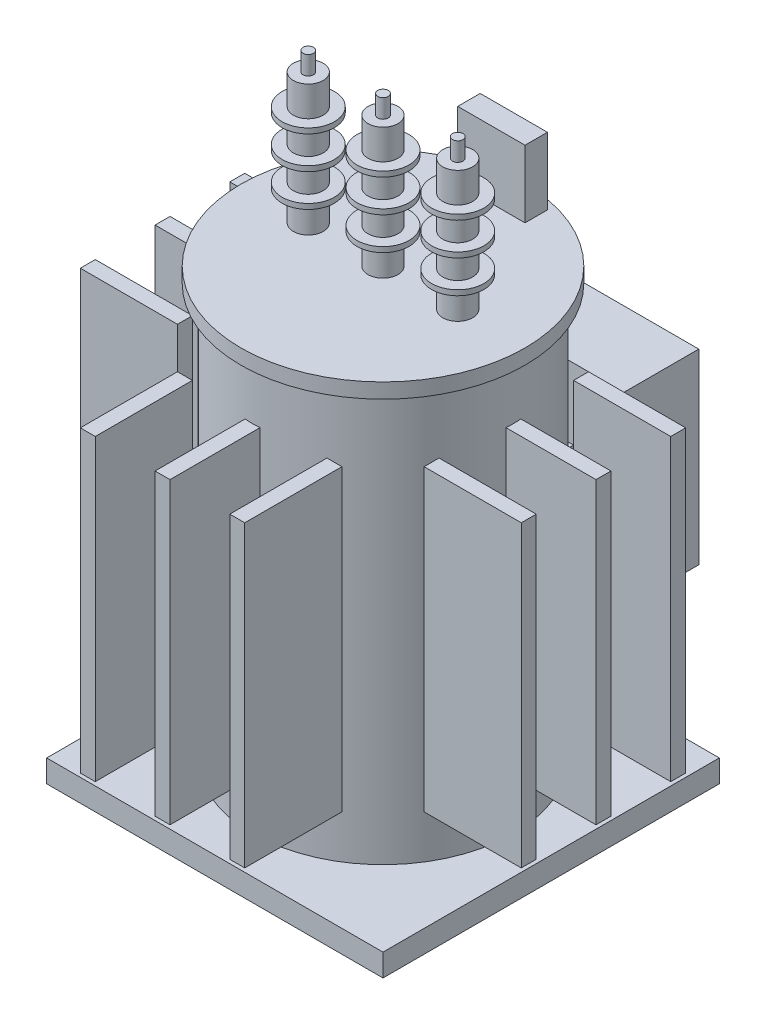
from build123d import *

# Parameters (mm, degrees)
SKETCH1_W                = 900
SKETCH1_H                = 900
BASE_DEPTH               = 60
TANK_START               = 60
SKETCH2_R                = 350
TANK_DEPTH               = 1100
LID_START                = 1160
SKETCH3_R                = 380
LID_DEPTH                = 40
FIN_START                = 210
SKETCH4_W                = 260
SKETCH4_H                = 40
FIN_X_1_DEPTH            = 800
SKETCH5_W                = 260
SKETCH5_H                = 40
FIN_X_1_2_DEPTH          = 800
SKETCH6_W                = 40
SKETCH6_H                = 260
FIN_Z_1_DEPTH            = 800
SKETCH7_W                = 260
SKETCH7_H                = 40
FIN_X_2_DEPTH            = 800
SKETCH8_W                = 260
SKETCH8_H                = 40
FIN_X_2_2_DEPTH          = 800
SKETCH9_W                = 40
SKETCH9_H                = 260
FIN_Z_2_DEPTH            = 800
SKETCH10_W               = 260
SKETCH10_H               = 40
FIN_X_3_DEPTH            = 800
SKETCH11_W               = 260
SKETCH11_H               = 40
FIN_X_3_2_DEPTH          = 800
SKETCH12_W               = 40
SKETCH12_H               = 260
FIN_Z_3_DEPTH            = 800
BUSHING_START            = 1200
SKETCH13_R               = 40
BUSHING_S_DEPTH          = 350
SHED_START               = 1280.5
SKETCH14_R               = 70
SHED_S_1_DEPTH           = 14
SHED_START_2             = 1368
SKETCH15_R               = 70
SHED_S_2_DEPTH           = 14
SHED_START_3             = 1455.5
SKETCH16_R               = 70
SHED_S_3_DEPTH           = 14
TERMINAL_START           = 1550
SKETCH17_R               = 14
TERMINAL_S_DEPTH         = 50
SKETCH18_R               = 40
BUSHING_L_DEPTH          = 350
SKETCH19_R               = 70
SHED_L_1_DEPTH           = 14
SKETCH20_R               = 70
SHED_L_2_DEPTH           = 14
SKETCH21_R               = 70
SHED_L_3_DEPTH           = 14
SKETCH22_R               = 14
TERMINAL_L_DEPTH         = 50
SKETCH23_R               = 40
BUSHING_SL_DEPTH         = 350
SKETCH24_R               = 70
SHED_SL_1_DEPTH          = 14
SKETCH25_R               = 70
SHED_SL_2_DEPTH          = 14
SKETCH26_R               = 70
SHED_SL_3_DEPTH          = 14
SKETCH27_R               = 14
TERMINAL_SL_DEPTH        = 50
POSITION_START           = 1200
SKETCH28_W               = 180
SKETCH28_H               = 60
POSITION_INDICATOR_DEPTH = 180
CONTROL_START            = 260
SKETCH29_W               = 350
SKETCH29_H               = 200
CONTROL_CABINET_DEPTH    = 500
CABINET_START            = 510
SKETCH30_W               = 80
SKETCH30_H               = 140
CABINET_BRACKET_DEPTH    = 60


with BuildPart() as part:
    # Sketch1 → Base (new body)
    with BuildSketch(Plane(origin=(0, 0, 0), x_dir=(1, 0, 0), z_dir=(0, 1, 0))):
        Rectangle(SKETCH1_W, SKETCH1_H)
    extrude(amount=BASE_DEPTH)


with BuildPart() as body_2:
    # Sketch2 → Tank (new body)
    with BuildSketch(Plane(origin=(0, 0, 0), x_dir=(1, 0, 0), z_dir=(0, 1, 0)).offset(TANK_START)):
        with Locations(Location((0, 0, 0), (0, 0, 270))):
            Circle(SKETCH2_R)
    extrude(amount=TANK_DEPTH)


with BuildPart() as body_3:
    # Sketch3 → Lid (new body)
    with BuildSketch(Plane(origin=(0, 0, 0), x_dir=(1, 0, 0), z_dir=(0, 1, 0)).offset(LID_START)):
        with Locations(Location((0, 0, 0), (0, 0, 270))):
            Circle(SKETCH3_R)
    extrude(amount=LID_DEPTH)


with BuildPart() as body_4:
    # Sketch4 → Fin _x 1 (new body)
    with BuildSketch(Plane(origin=(0, 0, 0), x_dir=(1, 0, 0), z_dir=(0, 1, 0)).offset(FIN_START)):
        with Locations((460, 200)):
            Rectangle(SKETCH4_W, SKETCH4_H)
    extrude(amount=FIN_X_1_DEPTH)


with BuildPart() as body_5:
    # Sketch5 → Fin -x 1 2 (new body)
    with BuildSketch(Plane(origin=(0, 0, 0), x_dir=(1, 0, 0), z_dir=(0, 1, 0)).offset(FIN_START)):
        with Locations((-460, 200)):
            Rectangle(SKETCH5_W, SKETCH5_H)
    extrude(amount=FIN_X_1_2_DEPTH)


with BuildPart() as body_6:
    # Sketch6 → Fin +z 1 (new body)
    with BuildSketch(Plane(origin=(0, 0, 0), x_dir=(1, 0, 0), z_dir=(0, 1, 0)).offset(FIN_START)):
        with Locations((-200, -460)):
            Rectangle(SKETCH6_W, SKETCH6_H)
    extrude(amount=FIN_Z_1_DEPTH)


with BuildPart() as body_7:
    # Sketch7 → Fin _x 2 (new body)
    with BuildSketch(Plane(origin=(0, 0, 0), x_dir=(1, 0, 0), z_dir=(0, 1, 0)).offset(FIN_START)):
        with Locations((460, 0)):
            Rectangle(SKETCH7_W, SKETCH7_H)
    extrude(amount=FIN_X_2_DEPTH)


with BuildPart() as body_8:
    # Sketch8 → Fin -x 2 2 (new body)
    with BuildSketch(Plane(origin=(0, 0, 0), x_dir=(1, 0, 0), z_dir=(0, 1, 0)).offset(FIN_START)):
        with Locations((-460, 0)):
            Rectangle(SKETCH8_W, SKETCH8_H)
    extrude(amount=FIN_X_2_2_DEPTH)


with BuildPart() as body_9:
    # Sketch9 → Fin +z 2 (new body)
    with BuildSketch(Plane(origin=(0, 0, 0), x_dir=(1, 0, 0), z_dir=(0, 1, 0)).offset(FIN_START)):
        with Locations((0, -460)):
            Rectangle(SKETCH9_W, SKETCH9_H)
    extrude(amount=FIN_Z_2_DEPTH)


with BuildPart() as body_10:
    # Sketch10 → Fin _x 3 (new body)
    with BuildSketch(Plane(origin=(0, 0, 0), x_dir=(1, 0, 0), z_dir=(0, 1, 0)).offset(FIN_START)):
        with Locations((460, -200)):
            Rectangle(SKETCH10_W, SKETCH10_H)
    extrude(amount=FIN_X_3_DEPTH)


with BuildPart() as body_11:
    # Sketch11 → Fin -x 3 2 (new body)
    with BuildSketch(Plane(origin=(0, 0, 0), x_dir=(1, 0, 0), z_dir=(0, 1, 0)).offset(FIN_START)):
        with Locations((-460, -200)):
            Rectangle(SKETCH11_W, SKETCH11_H)
    extrude(amount=FIN_X_3_2_DEPTH)


with BuildPart() as body_12:
    # Sketch12 → Fin +z 3 (new body)
    with BuildSketch(Plane(origin=(0, 0, 0), x_dir=(1, 0, 0), z_dir=(0, 1, 0)).offset(FIN_START)):
        with Locations((200, -460)):
            Rectangle(SKETCH12_W, SKETCH12_H)
    extrude(amount=FIN_Z_3_DEPTH)


with BuildPart() as body_13:
    # Sketch13 → Bushing S (new body)
    with BuildSketch(Plane(origin=(0, 0, 0), x_dir=(1, 0, 0), z_dir=(0, 1, 0)).offset(BUSHING_START)):
        with Locations(Location((-200, 0, 0), (0, 0, 270))):
            Circle(SKETCH13_R)
    extrude(amount=BUSHING_S_DEPTH)


with BuildPart() as body_14:
    # Sketch14 → Shed S 1 (new body)
    with BuildSketch(Plane(origin=(0, 0, 0), x_dir=(1, 0, 0), z_dir=(0, 1, 0)).offset(SHED_START)):
        with Locations(Location((-200, 0, 0), (0, 0, 270))):
            Circle(SKETCH14_R)
    extrude(amount=SHED_S_1_DEPTH)


with BuildPart() as body_15:
    # Sketch15 → Shed S 2 (new body)
    with BuildSketch(Plane(origin=(0, 0, 0), x_dir=(1, 0, 0), z_dir=(0, 1, 0)).offset(SHED_START_2)):
        with Locations(Location((-200, 0, 0), (0, 0, 270))):
            Circle(SKETCH15_R)
    extrude(amount=SHED_S_2_DEPTH)


with BuildPart() as body_16:
    # Sketch16 → Shed S 3 (new body)
    with BuildSketch(Plane(origin=(0, 0, 0), x_dir=(1, 0, 0), z_dir=(0, 1, 0)).offset(SHED_START_3)):
        with Locations(Location((-200, 0, 0), (0, 0, 270))):
            Circle(SKETCH16_R)
    extrude(amount=SHED_S_3_DEPTH)


with BuildPart() as body_17:
    # Sketch17 → Terminal S (new body)
    with BuildSketch(Plane(origin=(0, 0, 0), x_dir=(1, 0, 0), z_dir=(0, 1, 0)).offset(TERMINAL_START)):
        with Locations(Location((-200, 0, 0), (0, 0, 270))):
            Circle(SKETCH17_R)
    extrude(amount=TERMINAL_S_DEPTH)


with BuildPart() as body_18:
    # Sketch18 → Bushing L (new body)
    with BuildSketch(Plane(origin=(0, 0, 0), x_dir=(1, 0, 0), z_dir=(0, 1, 0)).offset(BUSHING_START)):
        with Locations(Location((0, 0, 0), (0, 0, 270))):
            Circle(SKETCH18_R)
    extrude(amount=BUSHING_L_DEPTH)


with BuildPart() as body_19:
    # Sketch19 → Shed L 1 (new body)
    with BuildSketch(Plane(origin=(0, 0, 0), x_dir=(1, 0, 0), z_dir=(0, 1, 0)).offset(SHED_START)):
        with Locations(Location((0, 0, 0), (0, 0, 270))):
            Circle(SKETCH19_R)
    extrude(amount=SHED_L_1_DEPTH)


with BuildPart() as body_20:
    # Sketch20 → Shed L 2 (new body)
    with BuildSketch(Plane(origin=(0, 0, 0), x_dir=(1, 0, 0), z_dir=(0, 1, 0)).offset(SHED_START_2)):
        with Locations(Location((0, 0, 0), (0, 0, 270))):
            Circle(SKETCH20_R)
    extrude(amount=SHED_L_2_DEPTH)


with BuildPart() as body_21:
    # Sketch21 → Shed L 3 (new body)
    with BuildSketch(Plane(origin=(0, 0, 0), x_dir=(1, 0, 0), z_dir=(0, 1, 0)).offset(SHED_START_3)):
        with Locations(Location((0, 0, 0), (0, 0, 270))):
            Circle(SKETCH21_R)
    extrude(amount=SHED_L_3_DEPTH)


with BuildPart() as body_22:
    # Sketch22 → Terminal L (new body)
    with BuildSketch(Plane(origin=(0, 0, 0), x_dir=(1, 0, 0), z_dir=(0, 1, 0)).offset(TERMINAL_START)):
        with Locations(Location((0, 0, 0), (0, 0, 270))):
            Circle(SKETCH22_R)
    extrude(amount=TERMINAL_L_DEPTH)


with BuildPart() as body_23:
    # Sketch23 → Bushing SL (new body)
    with BuildSketch(Plane(origin=(0, 0, 0), x_dir=(1, 0, 0), z_dir=(0, 1, 0)).offset(BUSHING_START)):
        with Locations(Location((200, 0, 0), (0, 0, 270))):
            Circle(SKETCH23_R)
    extrude(amount=BUSHING_SL_DEPTH)


with BuildPart() as body_24:
    # Sketch24 → Shed SL 1 (new body)
    with BuildSketch(Plane(origin=(0, 0, 0), x_dir=(1, 0, 0), z_dir=(0, 1, 0)).offset(SHED_START)):
        with Locations(Location((200, 0, 0), (0, 0, 270))):
            Circle(SKETCH24_R)
    extrude(amount=SHED_SL_1_DEPTH)


with BuildPart() as body_25:
    # Sketch25 → Shed SL 2 (new body)
    with BuildSketch(Plane(origin=(0, 0, 0), x_dir=(1, 0, 0), z_dir=(0, 1, 0)).offset(SHED_START_2)):
        with Locations(Location((200, 0, 0), (0, 0, 270))):
            Circle(SKETCH25_R)
    extrude(amount=SHED_SL_2_DEPTH)


with BuildPart() as body_26:
    # Sketch26 → Shed SL 3 (new body)
    with BuildSketch(Plane(origin=(0, 0, 0), x_dir=(1, 0, 0), z_dir=(0, 1, 0)).offset(SHED_START_3)):
        with Locations(Location((200, 0, 0), (0, 0, 270))):
            Circle(SKETCH26_R)
    extrude(amount=SHED_SL_3_DEPTH)


with BuildPart() as body_27:
    # Sketch27 → Terminal SL (new body)
    with BuildSketch(Plane(origin=(0, 0, 0), x_dir=(1, 0, 0), z_dir=(0, 1, 0)).offset(TERMINAL_START)):
        with Locations(Location((200, 0, 0), (0, 0, 270))):
            Circle(SKETCH27_R)
    extrude(amount=TERMINAL_SL_DEPTH)


with BuildPart() as body_28:
    # Sketch28 → Position indicator (new body)
    with BuildSketch(Plane(origin=(0, 0, 0), x_dir=(1, 0, 0), z_dir=(0, 1, 0)).offset(POSITION_START)):
        with Locations((0, 320)):
            Rectangle(SKETCH28_W, SKETCH28_H)
    extrude(amount=POSITION_INDICATOR_DEPTH)


with BuildPart() as body_29:
    # Sketch29 → Control cabinet (new body)
    with BuildSketch(Plane(origin=(0, 0, 0), x_dir=(1, 0, 0), z_dir=(0, 1, 0)).offset(CONTROL_START)):
        with Locations((0, 570)):
            Rectangle(SKETCH29_W, SKETCH29_H)
    extrude(amount=CONTROL_CABINET_DEPTH)


with BuildPart() as body_30:
    # Sketch30 → Cabinet bracket (new body)
    with BuildSketch(Plane(origin=(0, 0, 0), x_dir=(1, 0, 0), z_dir=(0, 1, 0)).offset(CABINET_START)):
        with Locations((0, 410)):
            Rectangle(SKETCH30_W, SKETCH30_H)
    extrude(amount=CABINET_BRACKET_DEPTH)


solid = Compound([part.part, body_2.part, body_3.part, body_4.part, body_5.part, body_6.part, body_7.part, body_8.part, body_9.part, body_10.part, body_11.part, body_12.part, body_13.part, body_14.part, body_15.part, body_16.part, body_17.part, body_18.part, body_19.part, body_20.part, body_21.part, body_22.part, body_23.part, body_24.part, body_25.part, body_26.part, body_27.part, body_28.part, body_29.part, body_30.part])
